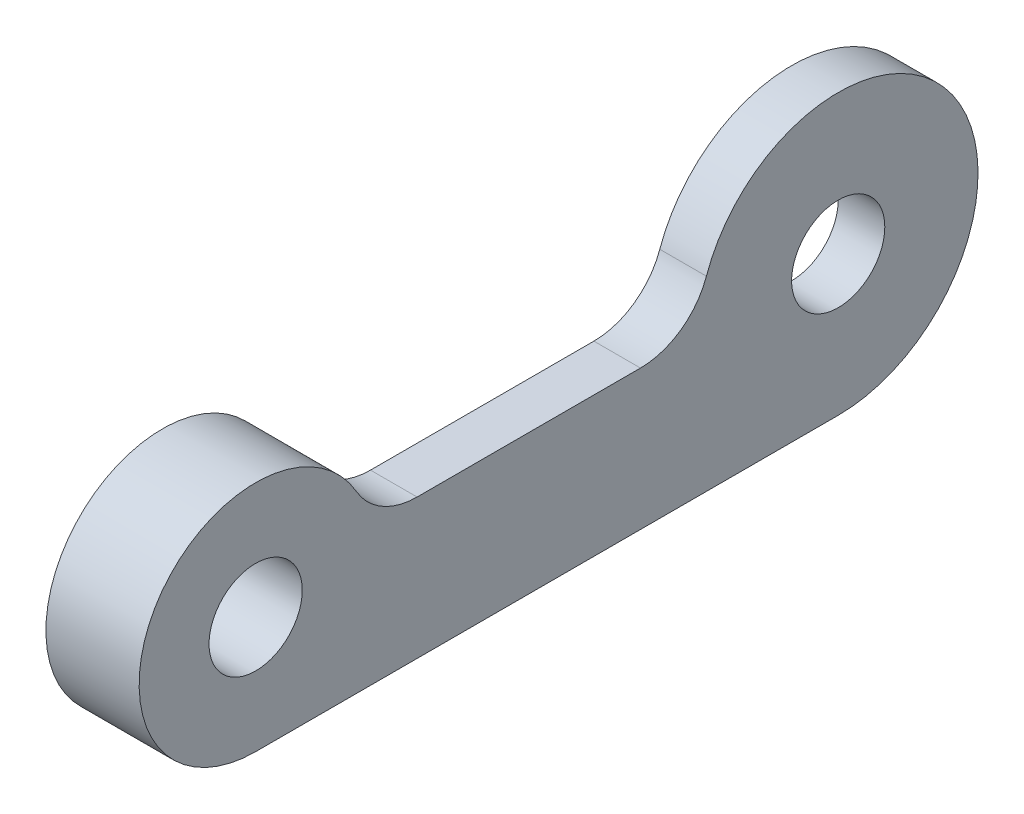
from build123d import *

# Parameters (mm, degrees)
SKETCH_1_R               = 5
SKETCH_1_R_2             = 6
SKETCH_1_W               = 25
SKETCH_1_H               = 6
EXTRUDE_1_DEPTH          = 2
EXTRUDE_START            = -2
SKETCH_1_5_R             = 5
EXTRUDE_3_DEPTH          = 2
CUT_EXTRUDE_2_DEPTH      = 32.638584039
CUT_EXTRUDE_2_DEPTH_BACK = 32.638584039
SKETCH_1_4_R             = 2
FILLET_1_R               = 3


with BuildPart() as part:
    # 草图1 → 凸台-拉伸1 (new body)
    with BuildSketch(Plane(origin=(0, 0, 0), x_dir=(0, 0, -1), z_dir=(1, 0, 0))):
        with Locations((0, -1)):
            Circle(SKETCH_1_R)
        with Locations((25, 0)):
            Circle(SKETCH_1_R_2)
        with Locations((12.5, -3)):
            Rectangle(SKETCH_1_W, SKETCH_1_H)
    extrude(amount=EXTRUDE_1_DEPTH)

    # 草图1<5> → 凸台-拉伸3 (add)
    with BuildSketch(Plane(origin=(0, 0, 0), x_dir=(0, 0, -1), z_dir=(1, 0, 0)).offset(EXTRUDE_START)):
        with Locations((0, -1)):
            Circle(SKETCH_1_5_R)
    extrude(amount=EXTRUDE_3_DEPTH)

    # 草图1<4> → 切除-拉伸2 (cut, two sides: drawn at the far end of the back side and taken through both)
    with BuildSketch(Plane(origin=(0, 0, 0), x_dir=(0, 0, -1), z_dir=(1, 0, 0)).offset(-CUT_EXTRUDE_2_DEPTH_BACK)):
        with Locations((0, -1)):
            Circle(SKETCH_1_4_R)
        with Locations((25, 0)):
            Circle(SKETCH_1_4_R)
    extrude(amount=CUT_EXTRUDE_2_DEPTH + CUT_EXTRUDE_2_DEPTH_BACK, mode=Mode.SUBTRACT)

    # 圆角1
    fillet_1_edges = [part.edges().sort_by_distance(p)[0] for p in [
        (1, 0, -19),
        (1, 0, -4.898979486),
    ]]
    fillet(fillet_1_edges, radius=FILLET_1_R)


solid = part.part
